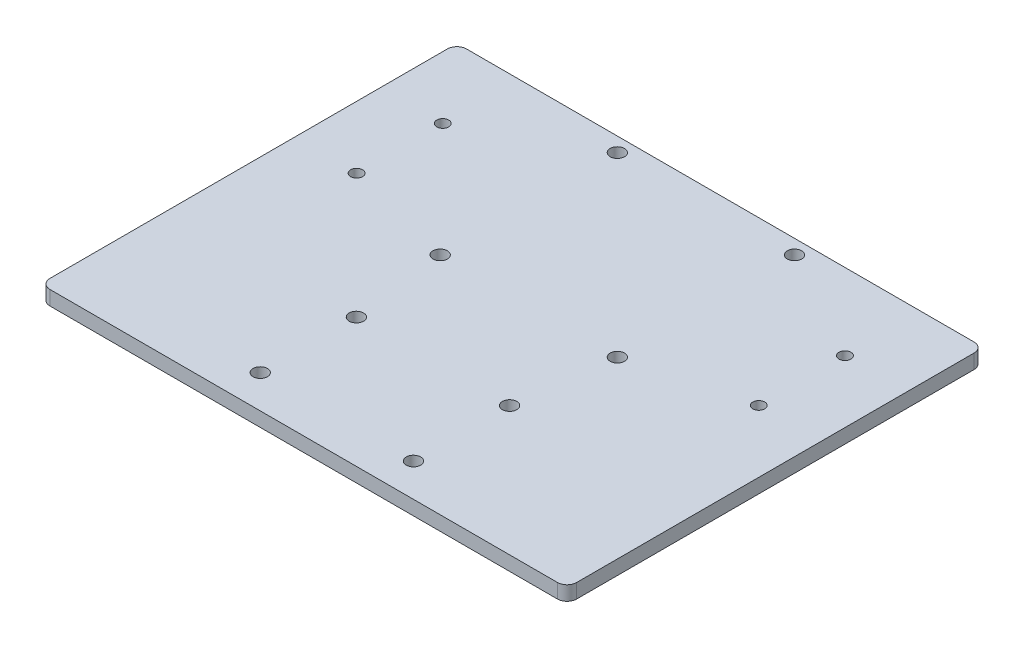
from build123d import *

# Parameters (mm, degrees)
IZIM1_W                     = 110
IZIM1_H                     = 87
Y_KSEKLIK_EKSTR_ZYON1_DEPTH = 3
RADYUS1_R                   = 2
IZIM2_R                     = 1.5
IZIM2_R_2                   = 1.25
KES_EKSTR_ZYON1_DEPTH       = 10


with BuildPart() as part:
    # Çizim1 → Yükseklik-Ekstrüzyon1 (new body)
    with BuildSketch(Plane(origin=(0, 0, 0), x_dir=(1, 0, 0), z_dir=(0, 1, 0))):
        Rectangle(IZIM1_W, IZIM1_H)
    extrude(amount=Y_KSEKLIK_EKSTR_ZYON1_DEPTH)

    # Radyus1
    radyus1_edges = [part.edges().sort_by_distance(p)[0] for p in [
        (55, 1.5, 43.5),
        (-55, 1.5, 43.5),
        (-55, 1.5, -43.5),
        (55, 1.5, -43.5),
    ]]
    fillet(radyus1_edges, radius=RADYUS1_R)

    # Çizim2 → Kes-Ekstrüzyon1 (cut)
    with BuildSketch(Plane(origin=(0, 3, 0), x_dir=(1, 0, 0), z_dir=(0, 1, 0))):
        with Locations(Location((-18.5, 40.5, 0), (0, 0, 270))):
            Circle(IZIM2_R)
        with Locations(Location((18.5, 40.5, 0), (0, 0, 270))):
            Circle(IZIM2_R)
        with Locations(Location((18.5, 3.5, 0), (0, 0, 270))):
            Circle(IZIM2_R)
        with Locations(Location((-18.5, 3.5, 0), (0, 0, 270))):
            Circle(IZIM2_R)
        with Locations(Location((-42, 27.54, 0), (0, 0, 270))):
            Circle(IZIM2_R_2)
        with Locations(Location((-42, 9.54, 0), (0, 0, 270))):
            Circle(IZIM2_R_2)
        with Locations(Location((42, 27.54, 0), (0, 0, 270))):
            Circle(IZIM2_R_2)
        with Locations(Location((42, 9.54, 0), (0, 0, 270))):
            Circle(IZIM2_R_2)
        with Locations(Location((-16, -36.58, 0), (0, 0, 270))):
            Circle(IZIM2_R)
        with Locations(Location((-16, -16.5, 0), (0, 0, 270))):
            Circle(IZIM2_R)
        with Locations(Location((16, -16.5, 0), (0, 0, 270))):
            Circle(IZIM2_R)
        with Locations(Location((16, -36.58, 0), (0, 0, 270))):
            Circle(IZIM2_R)
    extrude(amount=-KES_EKSTR_ZYON1_DEPTH, mode=Mode.SUBTRACT)


solid = part.part
